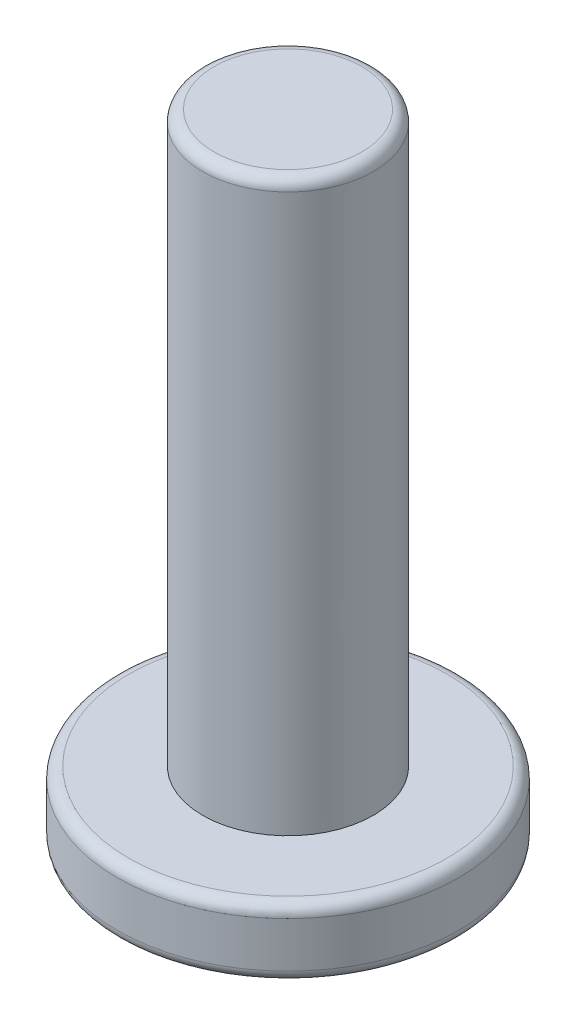
from build123d import *

# Parameters (mm, degrees)
FILLET1_R          = 0.2
CUT_EXTRUDE1_DEPTH = 1


with BuildPart() as part:
    # Sketch2 → Revolve1 (revolve)
    with BuildSketch(Plane.XY, mode=Mode.PRIVATE) as revolve1_sk:
        Polygon((0, 0), (3, 0), (3, 1.2), (1.5, 1.2), (1.5, 11.2), (0, 11.2), align=None)
    revolve(revolve1_sk.sketch.rotate(Axis((0, 73.114266362, 0), (0, -1, 0)), 90), axis=Axis((0, 73.114266362, 0), (0, -1, 0)))

    # Fillet1
    fillet1_edges = [part.edges().sort_by_distance(p)[0] for p in [
        (0, 11.2, -1.5),
        (0, 1.2, -3),
        (0, 0, -3),
    ]]
    fillet(fillet1_edges, radius=FILLET1_R)

    # Sketch3 → Cut-Extrude1 (cut)
    with BuildSketch(Plane.XZ):
        Polygon((1.443375673, 0), (0.721687836, 1.25), (-0.721687836, 1.25), (-1.443375673, 0), (-0.721687836, -1.25), (0.721687836, -1.25), align=None)
    extrude(amount=-CUT_EXTRUDE1_DEPTH, mode=Mode.SUBTRACT)


solid = part.part
